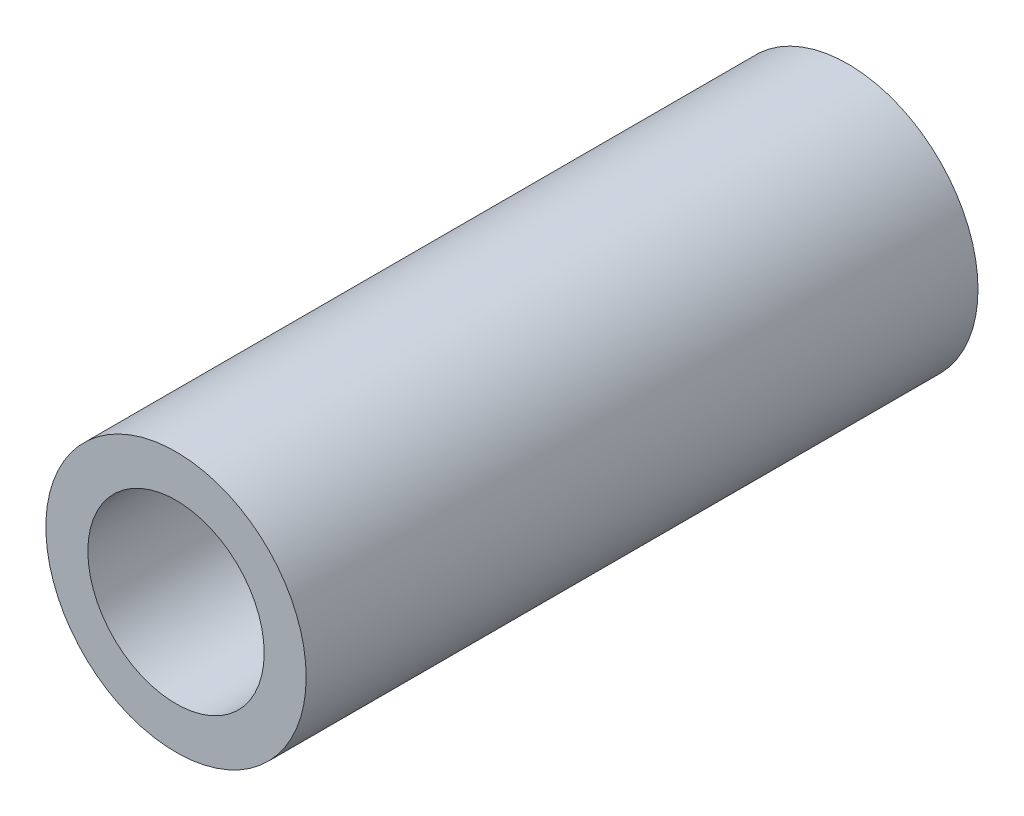
from build123d import *

# Parameters (mm, degrees)
SKETCH1_R           = 3.1
SKETCH1_R_2         = 2.1
BOSS_EXTRUDE1_DEPTH = 16


with BuildPart() as part:
    # Sketch1 → Boss-Extrude1 (new body)
    with BuildSketch(Plane.XY):
        Circle(SKETCH1_R)
        Circle(SKETCH1_R_2, mode=Mode.SUBTRACT)
    extrude(amount=BOSS_EXTRUDE1_DEPTH)


solid = part.part
